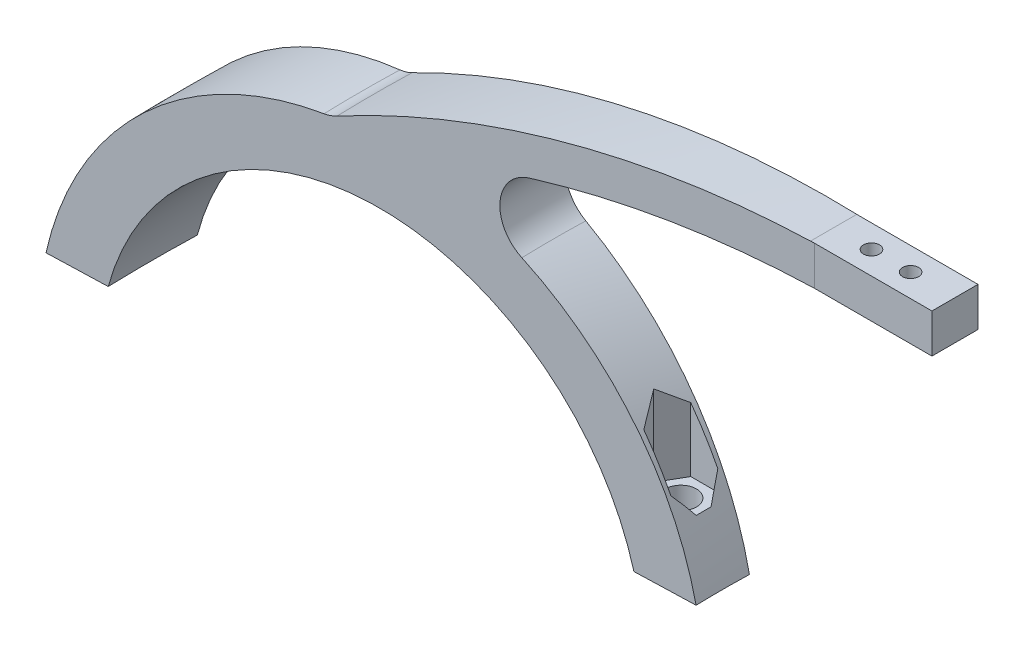
from build123d import *

# Parameters (mm, degrees)
REVOLVE_3_ANGLE           = 1.8
REVOLVE_3_OTHER_WAY_ANGLE = 1.8
CUT_EXTRUDE_1_REACH       = 147.503
SKETCH_9_R                = 4
FILLET_3_R                = 10
EXTRUDE_1_DEPTH           = 1
EXTRUDE_1_DEPTH_BACK      = 30
SKETCH_12_W               = 11.779034654
SKETCH_12_H               = 10
SKETCH_15_R               = 2.05
CUT_EXTRUDE_3_DEPTH       = 20
CUT_EXTRUDE_START         = -15
CUT_EXTRUDE_4_DEPTH       = 25


with BuildPart() as part:
    # 草图1 → 旋转3 (revolve)
    with BuildSketch(Plane.XY):
        with BuildLine():
            Line((110, 111.891696771), (110, 101.891696771))
            ThreePointArc((110, 101.891696771), (59.009804864, 96.84267245), (10, 81.891696771))
            ThreePointArc((10, 81.891696771), (55.584939873, 60.963632268), (80.622577483, 17.5))
            Line((80.622577483, 17.5), (65.192024052, 17.5))
            ThreePointArc((65.192024052, 17.5), (0, 67.5), (-65.192024052, 17.5))
            Line((-65.192024052, 17.5), (-80.622577483, 17.5))
            ThreePointArc((-80.622577483, 17.5), (-55.584939873, 60.963632268), (-10, 81.891696771))
            ThreePointArc((-10, 81.891696771), (48.153415616, 104.278034308), (110, 111.891696771))
        make_face()
    revolve(axis=Axis((297.5, 163.137568082, 0), (0, -1, 0)), revolution_arc=REVOLVE_3_ANGLE)

    # 草图1 → 旋转3 other way (revolve)
    with BuildSketch(Plane.XY):
        with BuildLine():
            Line((110, 111.891696771), (110, 101.891696771))
            ThreePointArc((110, 101.891696771), (59.009804864, 96.84267245), (10, 81.891696771))
            ThreePointArc((10, 81.891696771), (55.584939873, 60.963632268), (80.622577483, 17.5))
            Line((80.622577483, 17.5), (65.192024052, 17.5))
            ThreePointArc((65.192024052, 17.5), (0, 67.5), (-65.192024052, 17.5))
            Line((-65.192024052, 17.5), (-80.622577483, 17.5))
            ThreePointArc((-80.622577483, 17.5), (-55.584939873, 60.963632268), (-10, 81.891696771))
            ThreePointArc((-10, 81.891696771), (48.153415616, 104.278034308), (110, 111.891696771))
        make_face()
    revolve(axis=Axis((297.5, 163.137568082, 0), (0, 1, 0)), revolution_arc=REVOLVE_3_OTHER_WAY_ANGLE)

    # 草图9 → 切除-拉伸1 (cut, up to next)
    with BuildSketch(Plane.XZ.offset(-17.5), mode=Mode.PRIVATE) as cut_extrude_1_sk1:
        with Locations(Location((-70, 0, 0), (0, 0, 270))):
            Circle(SKETCH_9_R)
    cut_extrude_1_tool1 = extrude(cut_extrude_1_sk1.sketch, amount=-CUT_EXTRUDE_1_REACH, mode=Mode.PRIVATE) & part.part
    # 草图9 → 切除-拉伸1 (cut, up to next)
    with BuildSketch(Plane.XZ.offset(-17.5), mode=Mode.PRIVATE) as cut_extrude_1_sk2:
        with Locations(Location((70, 0, 0), (0, 0, 270))):
            Circle(SKETCH_9_R)
    cut_extrude_1_tool2 = extrude(cut_extrude_1_sk2.sketch, amount=-CUT_EXTRUDE_1_REACH, mode=Mode.PRIVATE) & part.part
    add(cut_extrude_1_tool1.solids().sort_by_distance((-70, 17.5, 0))[0], mode=Mode.SUBTRACT)
    add(cut_extrude_1_tool2.solids().sort_by_distance((70, 17.5, 0))[0], mode=Mode.SUBTRACT)

    # 圆角3
    fillet_3_edges = [part.edges().sort_by_distance(p)[0] for p in [
        (10.035468162, 81.891696771, -4.515853727),
        (-9.962064488, 81.891696771, -4.830000073),
    ]]
    fillet(fillet_3_edges, radius=FILLET_3_R)

    # 草图16 → 切除-拉伸4 (cut)
    with BuildSketch(Plane.XZ.offset(-17.5).offset(CUT_EXTRUDE_START)):
        Polygon((-63.07179677, 0), (-66.535898385, 6), (-73.464101615, 6), (-76.92820323, 0), (-73.464101615, -6), (-66.535898385, -6), align=None)
        Polygon((76.92820323, 0), (73.464101615, 6), (66.535898385, 6), (63.07179677, 0), (66.535898385, -6), (73.464101615, -6), align=None)
    extrude(amount=-CUT_EXTRUDE_4_DEPTH, mode=Mode.SUBTRACT)


with BuildPart() as body_2:
    # 草图12 → 凸台-拉伸1 (new, two sides: drawn at the far end of the back side and taken through both)
    with BuildSketch(Plane.ZY.offset(-110.092519931).offset(-EXTRUDE_1_DEPTH_BACK)):
        with Locations((0, 106.891696771)):
            Rectangle(SKETCH_12_W, SKETCH_12_H)
    extrude(amount=EXTRUDE_1_DEPTH + EXTRUDE_1_DEPTH_BACK)

    # 草图15 → 切除-拉伸3 (cut)
    with BuildSketch(Plane(origin=(0, 111.891696771, 0), x_dir=(1, 0, 0), z_dir=(0, 1, 0))):
        with Locations(Location((128.75, 0, 0), (0, 0, 180))):
            Circle(SKETCH_15_R)
        with Locations(Location((118.75, 0, 0), (0, 0, 180))):
            Circle(SKETCH_15_R)
    extrude(amount=-CUT_EXTRUDE_3_DEPTH, mode=Mode.SUBTRACT)


solid = Compound([part.part, body_2.part])
